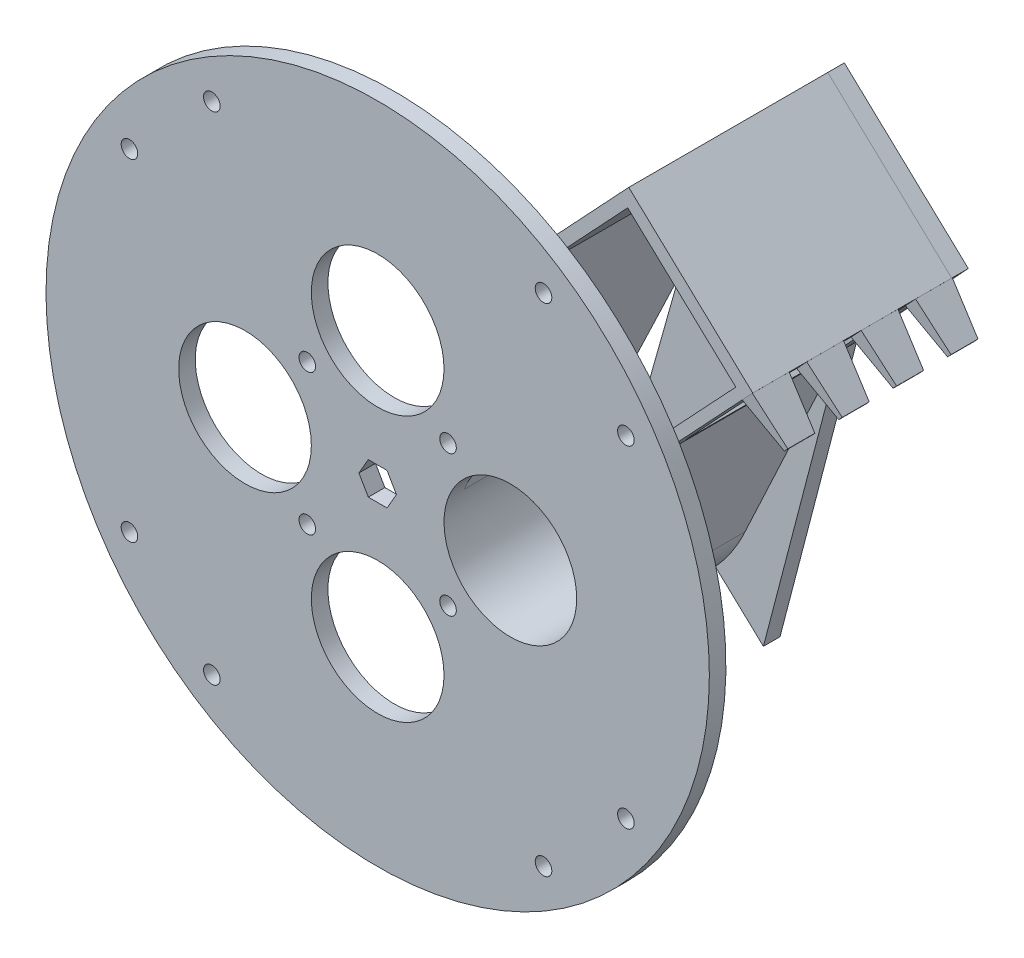
from build123d import *
from build123d.topology import SkipClean

# Parameters (mm, degrees)
SKETCH1_R                     = 127
SKETCH1_R_2                   = 25.4
BOSS_EXTRUDE1_DEPTH           = 6.35
SKETCH3_R                     = 3.175
CUT_EXTRUDE1_DEPTH            = 6.35
BOSS_EXTRUDE3_START           = 76.2
BOSS_EXTRUDE3_DEPTH           = 76.2
SKETCH8_W                     = 50.8
SKETCH8_H                     = 50.8
CUT_EXTRUDE2_DEPTH            = 6.35
BOSS_EXTRUDE4_DEPTH           = 6.35
SKETCH12_W                    = 14.076199653
SKETCH12_H                    = 5.676094201
BOSS_EXTRUDE5_DEPTH           = 17.78
BOSS_EXTRUDE5_DRAFT           = 6
BOSS_EXTRUDE5_PROFILE_2_DEPTH = 17.78
BOSS_EXTRUDE5_PROFILE_2_DRAFT = 6
BOSS_EXTRUDE5_PROFILE_3_DEPTH = 17.78
BOSS_EXTRUDE5_PROFILE_3_DRAFT = 6
BOSS_EXTRUDE5_PROFILE_4_DEPTH = 17.78
BOSS_EXTRUDE5_PROFILE_4_DRAFT = 6
SKETCH16_W                    = 137.632835606
SKETCH16_H                    = 86.689422116
CUT_EXTRUDE4_DEPTH            = 38.1


with BuildPart() as part:
    # Sketch1 → Boss-Extrude1 (new body)
    with BuildSketch(Plane.XY):
        Circle(SKETCH1_R)
        with Locations((0, 50.8)):
            Circle(SKETCH1_R_2, mode=Mode.SUBTRACT)
        with Locations((50.8, 0)):
            Circle(SKETCH1_R_2, mode=Mode.SUBTRACT)
        with Locations((0, -50.8)):
            Circle(SKETCH1_R_2, mode=Mode.SUBTRACT)
        with Locations((-50.8, 0)):
            Circle(SKETCH1_R_2, mode=Mode.SUBTRACT)
        Polygon((7.18570145, 0), (3.592850725, 6.223), (-3.592850725, 6.223), (-7.18570145, 0), (-3.592850725, -6.223), (3.592850725, -6.223), align=None, mode=Mode.SUBTRACT)
    extrude(amount=BOSS_EXTRUDE1_DEPTH)

    # Sketch3 → Cut-Extrude1 (cut)
    with BuildSketch(Plane(origin=(0, 0, 0), x_dir=(-1, 0, 0), z_dir=(0, 0, -1))):
        with Locations((-26.940768363, 26.940768363)):
            Circle(SKETCH3_R)
        with Locations((26.940768363, 26.940768363)):
            Circle(SKETCH3_R)
        with Locations((26.940768363, -26.940768363)):
            Circle(SKETCH3_R)
        with Locations((-26.940768363, -26.940768363)):
            Circle(SKETCH3_R)
        with Locations((-63.5, 95.038097624)):
            Circle(SKETCH3_R)
        with Locations((63.5, 95.038097624)):
            Circle(SKETCH3_R)
        with Locations((95.038097624, 63.5)):
            Circle(SKETCH3_R)
        with Locations((95.038097624, -63.5)):
            Circle(SKETCH3_R)
        with Locations((63.5, -95.038097624)):
            Circle(SKETCH3_R)
        with Locations((-63.5, -95.038097624)):
            Circle(SKETCH3_R)
        with Locations((-95.038097624, -63.5)):
            Circle(SKETCH3_R)
        with Locations((-95.038097624, 63.5)):
            Circle(SKETCH3_R)
    extrude(amount=-CUT_EXTRUDE1_DEPTH, mode=Mode.SUBTRACT)

    # Sketch4 → Boss-Extrude3 (add)
    with SkipClean():  # the faces are left unmerged after this step: merging them gives an invalid solid
        with BuildSketch(Plane(origin=(0, 0, 0), x_dir=(-1, 0, 0), z_dir=(0, 0, -1)).offset(BOSS_EXTRUDE3_START)):
            with BuildLine():
                ThreePointArc((-79.185130885, -7.062226276), (-42.854710858, -28.150720697), (-22.911154448, 8.82060027))
                Line((-22.911154448, 8.82060027), (-27.126431814, 23.771201503))
                ThreePointArc((-27.126431814, 23.771201503), (-29.996629318, 26.079177494), (-28.75477002, 29.546535619))
                Line((-28.75477002, 29.546535619), (-47.031154579, 94.368589733))
                Line((-47.031154579, 94.368589733), (-89.78967593, 140.019925662))
                Line((-89.78967593, 140.019925662), (-137.260674726, 95.557049073))
                Line((-137.260674726, 95.557049073), (-94.502153375, 49.905713144))
                Line((-94.502153375, 49.905713144), (-79.185130885, -7.062226276))
            make_face()
            with BuildLine():
                Line((-91.690310224, 52.539376605), (-130.775049183, 94.268381527))
                Line((-130.775049183, 94.268381527), (-89.388084982, 133.032754057))
                Line((-89.388084982, 133.032754057), (-50.303346023, 91.303749135))
                Line((-50.303346023, 91.303749135), (-26.857967073, 8.48168965))
                ThreePointArc((-26.857967073, 8.48168965), (-43.508670742, -24.330978559), (-75.460781141, -6.083245311))
                Line((-75.460781141, -6.083245311), (-91.690310224, 52.539376605))
            make_face(mode=Mode.SUBTRACT)
        extrude(amount=-BOSS_EXTRUDE3_DEPTH)

    # Sketch8 → Cut-Extrude2 (cut)
    with SkipClean():  # the faces are left unmerged after this step: merging them gives an invalid solid
        with BuildSketch(Plane(origin=(25.440444099, -23.82834478, 0), x_dir=(0, 0, -1), z_dir=(0.729853070223302, -0.683604049055899, 0))):
            with Locations((38.1, 132.300225659)):
                Rectangle(SKETCH8_W, SKETCH8_H)
        extrude(amount=-CUT_EXTRUDE2_DEPTH, mode=Mode.SUBTRACT)


with BuildPart() as body_2:
    # Sketch6 → Boss-Extrude4 (new body)
    with BuildSketch(Plane(origin=(0, 0, -76.2), x_dir=(-1, 0, 0), z_dir=(0, 0, -1))):
        Polygon((-15.801225201, -16.396653006), (-47.031154579, 94.368589733), (-89.78967593, 140.019925662), (-137.260674726, 95.557049073), (-94.502153375, 49.905713144), (-65.150179146, -62.618483276), align=None)
    extrude(amount=BOSS_EXTRUDE4_DEPTH)


with BuildPart() as boss_extrude5_tool:
    # Sketch12 → Boss-Extrude5 (with draft: the straight prism first)
    with BuildSketch(Plane(origin=(25.440444099, -23.82834478, 0), x_dir=(0, 0, -1), z_dir=(0.7298530702233252, -0.6836040490558741, 0))):
        with Locations((7.038099827, 160.53827276)):
            Rectangle(SKETCH12_W, SKETCH12_H)
    extrude(amount=BOSS_EXTRUDE5_DEPTH)
    # Boss-Extrude5: the draft: its side faces are tilted about the plane it starts from
    boss_extrude5_sides = [boss_extrude5_tool.faces().sort_by_distance(p)[0] for p in [
        (141.67345118, 87.263766485, 0),
        (139.733350691, 85.192409096, -7.038099826),
        (141.67345118, 87.263766485, -14.076199653),
        (143.613551669, 89.335123875, -7.038099826),
    ]]
    draft(boss_extrude5_sides, Plane(origin=(25.440444099, -23.82834478, 0), x_dir=(0, 0, -1), z_dir=(0.7298530702233252, -0.6836040490558741, 0)), BOSS_EXTRUDE5_DRAFT)


with BuildPart() as part_1:
    add(part.part)

    # Boss-Extrude5: add boss_extrude5_tool
    add(boss_extrude5_tool.part)


with BuildPart() as boss_extrude5_profile_2_tool:
    # Sketch12 → Boss-Extrude5 profile 2 (with draft: the straight prism first)
    with BuildSketch(Plane(origin=(25.440444099, -23.82834478, 0), x_dir=(0, 0, -1), z_dir=(0.7298530702233252, -0.6836040490558741, 0))):
        with Locations((27.866099827, 160.53827276)):
            Rectangle(SKETCH12_W, SKETCH12_H)
    extrude(amount=BOSS_EXTRUDE5_PROFILE_2_DEPTH)
    # Boss-Extrude5 profile 2: the draft: its side faces are tilted about the plane it starts from
    boss_extrude5_profile_2_sides = [boss_extrude5_profile_2_tool.faces().sort_by_distance(p)[0] for p in [
        (141.67345118, 87.263766485, -20.828),
        (139.733350691, 85.192409096, -27.866099826),
        (141.67345118, 87.263766485, -34.904199653),
        (143.613551669, 89.335123875, -27.866099826),
    ]]
    draft(boss_extrude5_profile_2_sides, Plane(origin=(25.440444099, -23.82834478, 0), x_dir=(0, 0, -1), z_dir=(0.7298530702233252, -0.6836040490558741, 0)), BOSS_EXTRUDE5_PROFILE_2_DRAFT)


with BuildPart() as part_2:
    add(part_1.part)

    # Boss-Extrude5 profile 2: add boss_extrude5_profile_2_tool
    add(boss_extrude5_profile_2_tool.part)


with BuildPart() as boss_extrude5_profile_3_tool:
    # Sketch12 → Boss-Extrude5 profile 3 (with draft: the straight prism first)
    with BuildSketch(Plane(origin=(25.440444099, -23.82834478, 0), x_dir=(0, 0, -1), z_dir=(0.7298530702233252, -0.6836040490558741, 0))):
        with Locations((48.694099827, 160.53827276)):
            Rectangle(SKETCH12_W, SKETCH12_H)
    extrude(amount=BOSS_EXTRUDE5_PROFILE_3_DEPTH)
    # Boss-Extrude5 profile 3: the draft: its side faces are tilted about the plane it starts from
    boss_extrude5_profile_3_sides = [boss_extrude5_profile_3_tool.faces().sort_by_distance(p)[0] for p in [
        (141.67345118, 87.263766485, -41.656),
        (139.733350691, 85.192409096, -48.694099826),
        (141.67345118, 87.263766485, -55.732199653),
        (143.613551669, 89.335123875, -48.694099826),
    ]]
    draft(boss_extrude5_profile_3_sides, Plane(origin=(25.440444099, -23.82834478, 0), x_dir=(0, 0, -1), z_dir=(0.7298530702233252, -0.6836040490558741, 0)), BOSS_EXTRUDE5_PROFILE_3_DRAFT)


with BuildPart() as part_3:
    add(part_2.part)

    # Boss-Extrude5 profile 3: add boss_extrude5_profile_3_tool
    add(boss_extrude5_profile_3_tool.part)


with BuildPart() as boss_extrude5_profile_4_tool:
    # Sketch12 → Boss-Extrude5 profile 4 (with draft: the straight prism first)
    with BuildSketch(Plane(origin=(25.440444099, -23.82834478, 0), x_dir=(0, 0, -1), z_dir=(0.7298530702233252, -0.6836040490558741, 0))):
        with Locations((69.522099826, 160.53827276)):
            Rectangle(SKETCH12_W, SKETCH12_H)
    extrude(amount=BOSS_EXTRUDE5_PROFILE_4_DEPTH)
    # Boss-Extrude5 profile 4: the draft: its side faces are tilted about the plane it starts from
    boss_extrude5_profile_4_sides = [boss_extrude5_profile_4_tool.faces().sort_by_distance(p)[0] for p in [
        (141.67345118, 87.263766485, -62.484),
        (139.733350691, 85.192409096, -69.522099826),
        (141.67345118, 87.263766485, -76.560199653),
        (143.613551669, 89.335123875, -69.522099826),
    ]]
    draft(boss_extrude5_profile_4_sides, Plane(origin=(25.440444099, -23.82834478, 0), x_dir=(0, 0, -1), z_dir=(0.7298530702233252, -0.6836040490558741, 0)), BOSS_EXTRUDE5_PROFILE_4_DRAFT)


with BuildPart() as part_4:
    add(part_3.part)

    # Boss-Extrude5 profile 4: add boss_extrude5_profile_4_tool
    add(boss_extrude5_profile_4_tool.part)

    # Sketch16 → Cut-Extrude4 (cut)
    with SkipClean():  # the faces are left unmerged after this step: merging them gives an invalid solid
        with BuildSketch(Plane(origin=(-4.289146896, -15.21259915, -44.204164058), x_dir=(0.2444923951386014, 0.90932999306756, -0.3366636785088964), z_dir=(0.0913654641407042, 0.32405189556873676, 0.9416170776598427))):
            with Locations((50.704983573, -59.606984753)):
                Rectangle(SKETCH16_W, SKETCH16_H)
        extrude(amount=-CUT_EXTRUDE4_DEPTH, mode=Mode.SUBTRACT)


solid = Compound([body_2.part, part_4.part])
